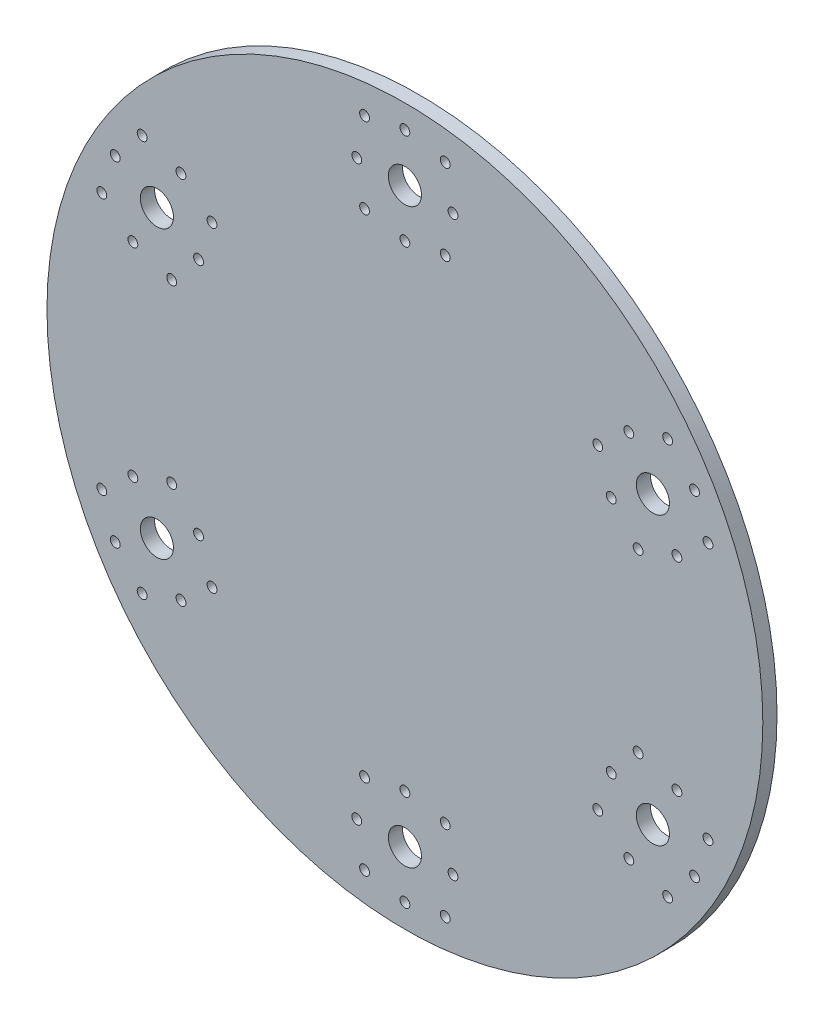
from build123d import *

# Parameters (mm, degrees)
SKETCH1_R           = 80
SKETCH1_R_2         = 1.1
SKETCH1_R_3         = 3.7
BOSS_EXTRUDE2_DEPTH = 3.175


with BuildPart() as part:
    # Sketch1 → Boss-Extrude2 (new body)
    with BuildSketch(Plane.XY):
        Circle(SKETCH1_R)
        with Locations((58.725568667, 44.315554285)):
            Circle(SKETCH1_R_2, mode=Mode.SUBTRACT)
        with Locations((67.741180127, 28.700057175)):
            Circle(SKETCH1_R_2, mode=Mode.SUBTRACT)
        with Locations((64.735398933, 37.375)):
            Circle(SKETCH1_R_2, mode=Mode.SUBTRACT)
        with Locations((50.050625842, 41.309773091)):
            Circle(SKETCH1_R_2, mode=Mode.SUBTRACT)
        with Locations((52.125683017, 19.684445715)):
            Circle(SKETCH1_R_2, mode=Mode.SUBTRACT)
        with Locations((43.110071557, 35.299942825)):
            Circle(SKETCH1_R_2, mode=Mode.SUBTRACT)
        with Locations((60.800625842, 22.690226909)):
            Circle(SKETCH1_R_2, mode=Mode.SUBTRACT)
        with Locations((46.115852752, 26.625)):
            Circle(SKETCH1_R_2, mode=Mode.SUBTRACT)
        with Locations((55.425625842, 32)):
            Circle(SKETCH1_R_3, mode=Mode.SUBTRACT)
        with Locations((-10.75, 64)):
            Circle(SKETCH1_R_2, mode=Mode.SUBTRACT)
        with Locations((-9.01561146, 73.01561146)):
            Circle(SKETCH1_R_2, mode=Mode.SUBTRACT)
        with Locations((9.01561146, 73.01561146)):
            Circle(SKETCH1_R_2, mode=Mode.SUBTRACT)
        with Locations((9.01561146, 54.98438854)):
            Circle(SKETCH1_R_2, mode=Mode.SUBTRACT)
        with Locations((-9.01561146, 54.98438854)):
            Circle(SKETCH1_R_2, mode=Mode.SUBTRACT)
        with Locations((0, 74.75)):
            Circle(SKETCH1_R_2, mode=Mode.SUBTRACT)
        with Locations((10.75, 64)):
            Circle(SKETCH1_R_2, mode=Mode.SUBTRACT)
        with Locations((0, 53.25)):
            Circle(SKETCH1_R_2, mode=Mode.SUBTRACT)
        with Locations((0, 64)):
            Circle(SKETCH1_R_3, mode=Mode.SUBTRACT)
        with Locations((67.741180127, -28.700057175)):
            Circle(SKETCH1_R_2, mode=Mode.SUBTRACT)
        with Locations((58.725568667, -44.315554285)):
            Circle(SKETCH1_R_2, mode=Mode.SUBTRACT)
        with Locations((64.735398933, -37.375)):
            Circle(SKETCH1_R_2, mode=Mode.SUBTRACT)
        with Locations((60.800625842, -22.690226909)):
            Circle(SKETCH1_R_2, mode=Mode.SUBTRACT)
        with Locations((43.110071557, -35.299942825)):
            Circle(SKETCH1_R_2, mode=Mode.SUBTRACT)
        with Locations((52.125683017, -19.684445715)):
            Circle(SKETCH1_R_2, mode=Mode.SUBTRACT)
        with Locations((50.050625842, -41.309773091)):
            Circle(SKETCH1_R_2, mode=Mode.SUBTRACT)
        with Locations((46.115852752, -26.625)):
            Circle(SKETCH1_R_2, mode=Mode.SUBTRACT)
        with Locations((55.425625842, -32)):
            Circle(SKETCH1_R_3, mode=Mode.SUBTRACT)
        with Locations((9.01561146, -73.01561146)):
            Circle(SKETCH1_R_2, mode=Mode.SUBTRACT)
        with Locations((-9.01561146, -73.01561146)):
            Circle(SKETCH1_R_2, mode=Mode.SUBTRACT)
        with Locations((0, -74.75)):
            Circle(SKETCH1_R_2, mode=Mode.SUBTRACT)
        with Locations((10.75, -64)):
            Circle(SKETCH1_R_2, mode=Mode.SUBTRACT)
        with Locations((-9.01561146, -54.98438854)):
            Circle(SKETCH1_R_2, mode=Mode.SUBTRACT)
        with Locations((9.01561146, -54.98438854)):
            Circle(SKETCH1_R_2, mode=Mode.SUBTRACT)
        with Locations((-10.75, -64)):
            Circle(SKETCH1_R_2, mode=Mode.SUBTRACT)
        with Locations((0, -53.25)):
            Circle(SKETCH1_R_2, mode=Mode.SUBTRACT)
        with Locations((0, -64)):
            Circle(SKETCH1_R_3, mode=Mode.SUBTRACT)
        with Locations((-58.725568667, -44.315554285)):
            Circle(SKETCH1_R_2, mode=Mode.SUBTRACT)
        with Locations((-67.741180127, -28.700057175)):
            Circle(SKETCH1_R_2, mode=Mode.SUBTRACT)
        with Locations((-64.735398933, -37.375)):
            Circle(SKETCH1_R_2, mode=Mode.SUBTRACT)
        with Locations((-50.050625842, -41.309773091)):
            Circle(SKETCH1_R_2, mode=Mode.SUBTRACT)
        with Locations((-52.125683017, -19.684445715)):
            Circle(SKETCH1_R_2, mode=Mode.SUBTRACT)
        with Locations((-43.110071557, -35.299942825)):
            Circle(SKETCH1_R_2, mode=Mode.SUBTRACT)
        with Locations((-60.800625842, -22.690226909)):
            Circle(SKETCH1_R_2, mode=Mode.SUBTRACT)
        with Locations((-46.115852752, -26.625)):
            Circle(SKETCH1_R_2, mode=Mode.SUBTRACT)
        with Locations((-55.425625842, -32)):
            Circle(SKETCH1_R_3, mode=Mode.SUBTRACT)
        with Locations((-67.741180127, 28.700057175)):
            Circle(SKETCH1_R_2, mode=Mode.SUBTRACT)
        with Locations((-58.725568667, 44.315554285)):
            Circle(SKETCH1_R_2, mode=Mode.SUBTRACT)
        with Locations((-64.735398933, 37.375)):
            Circle(SKETCH1_R_2, mode=Mode.SUBTRACT)
        with Locations((-60.800625842, 22.690226909)):
            Circle(SKETCH1_R_2, mode=Mode.SUBTRACT)
        with Locations((-43.110071557, 35.299942825)):
            Circle(SKETCH1_R_2, mode=Mode.SUBTRACT)
        with Locations((-52.125683017, 19.684445715)):
            Circle(SKETCH1_R_2, mode=Mode.SUBTRACT)
        with Locations((-50.050625842, 41.309773091)):
            Circle(SKETCH1_R_2, mode=Mode.SUBTRACT)
        with Locations((-46.115852752, 26.625)):
            Circle(SKETCH1_R_2, mode=Mode.SUBTRACT)
        with Locations((-55.425625842, 32)):
            Circle(SKETCH1_R_3, mode=Mode.SUBTRACT)
    extrude(amount=BOSS_EXTRUDE2_DEPTH)


solid = part.part
